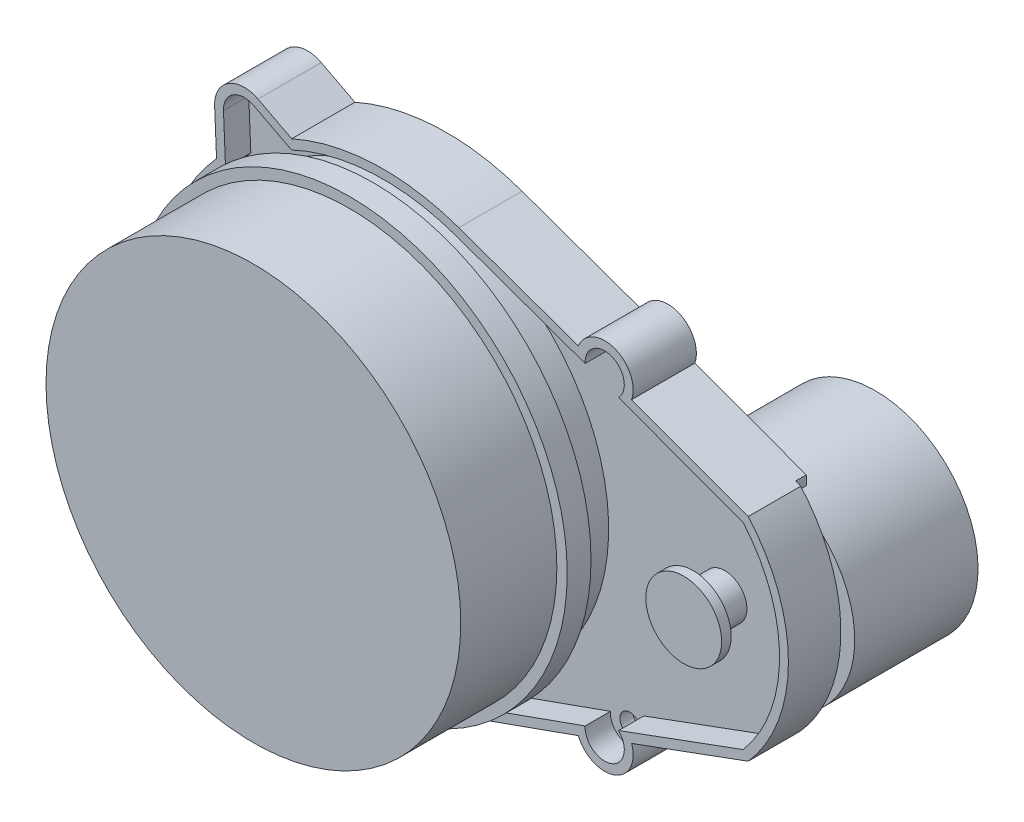
from build123d import *

# Parameters (mm, degrees)
SKETCH_2_R               = 32.8
EXTRUDE_1_DEPTH          = 15.2
SKETCH_5_R               = 34.43969611
EXTRUDE_2_DEPTH          = 3.765573
SKETCH_7_R               = 31.937051091
EXTRUDE_3_DEPTH          = 0.8
SKETCH_8_R               = 31.627841621
EXTRUDE_4_DEPTH          = 4.8
EXTRUDE_6_DEPTH          = 2
EXTRUDE_START            = 4
EXTRUDE_7_DEPTH          = 4
EXTRUDE_8_DEPTH          = 6
CUT_EXTRUDE_1_DEPTH      = 1.7
SKETCH_14_R              = 3.5
EXTRUDE_9_DEPTH          = 5
SKETCH_15_R              = 6
EXTRUDE_10_DEPTH         = 1.5
EXTRUDE_START_2          = 2.3
SKETCH_16_R              = 3.5
EXTRUDE_11_DEPTH         = 2.3
SKETCH_17_R              = 16.25
EXTRUDE_12_DEPTH         = 19.5
SKETCH_18_R              = 3.75
EXTRUDE_13_DEPTH         = 3.43
EXTRUDE_14_DEPTH         = 12.23
CUT_EXTRUDE_2_DEPTH      = 81.031402587
CUT_EXTRUDE_2_DEPTH_BACK = 81.031402587
SKETCH_20_R              = 1.6
SKETCH_21_R              = 5.25
CUT_EXTRUDE_3_DEPTH      = 20


with BuildPart() as part:
    # 스케치2 → 보스-돌출1 (new body)
    with BuildSketch(Plane.XY):
        with Locations(Location((0, 0, 0), (0, 0, 180))):
            Circle(SKETCH_2_R)
    extrude(amount=EXTRUDE_1_DEPTH)

    # 스케치5 → 보스-돌출2 (add)
    with BuildSketch(Plane.XY):
        Circle(SKETCH_5_R)
    extrude(amount=-EXTRUDE_2_DEPTH)

    # 스케치7 → 보스-돌출3 (add)
    with BuildSketch(Plane(origin=(0, 0, -3.765572979), x_dir=(-1, 0, 0), z_dir=(0, 0, -1))):
        Circle(SKETCH_7_R)
    extrude(amount=EXTRUDE_3_DEPTH)

    # 스케치8 → 보스-돌출4 (add)
    with BuildSketch(Plane(origin=(0, 0, -4.565572979), x_dir=(-1, 0, 0), z_dir=(0, 0, -1))):
        Circle(SKETCH_8_R)
    extrude(amount=EXTRUDE_4_DEPTH)

    # 스케치10 → 보스-돌출6 (add)
    with BuildSketch(Plane(origin=(0, 0, -9.365572979), x_dir=(-1, 0, 0), z_dir=(0, 0, -1))):
        with BuildLine():
            Line((-30.830427643, -26.692532528), (-11.928490857, -33.435925378))
            ThreePointArc((-11.928490857, -33.435925378), (1.386891377, -35.472898561), (14.502591336, -32.402543797))
            Line((14.502591336, -32.402543797), (19.833940849, -35.171113491))
            ThreePointArc((19.833940849, -35.171113491), (24.525943879, -34.963534725), (26.69566429, -30.798166229))
            Line((26.69566429, -30.798166229), (26.392377939, -23.742206863))
            ThreePointArc((26.392377939, -23.742206863), (35.5, 0), (26.392377939, 23.742206863))
            Line((26.392377939, 23.742206863), (26.69566429, 30.798166229))
            ThreePointArc((26.69566429, 30.798166229), (24.525943879, 34.963534725), (19.833940849, 35.171113491))
            Line((19.833940849, 35.171113491), (14.502591336, 32.402543797))
            ThreePointArc((14.502591336, 32.402543797), (1.386891377, 35.472898561), (-11.928490857, 33.435925378))
            Line((-11.928490857, 33.435925378), (-30.830427643, 26.692532528))
            ThreePointArc((-30.830427643, 26.692532528), (-36.575929002, 29.215026427), (-39.257220366, 23.541893434))
            Line((-39.257220366, 23.541893434), (-57.703429714, 16.761281639))
            ThreePointArc((-57.703429714, 16.761281639), (-64.057876626, 0), (-57.703429714, -16.761281639))
            Line((-57.703429714, -16.761281639), (-39.257220366, -23.541893434))
            ThreePointArc((-39.257220366, -23.541893434), (-36.575929002, -29.215026427), (-30.830427643, -26.692532528))
        make_face()
    extrude(amount=EXTRUDE_6_DEPTH)

    # 스케치12 → 보스-돌출7 (add)
    with BuildSketch(Plane.XY.offset(-9.365572979).offset(EXTRUDE_START)):
        with BuildLine():
            Line((-26.392377939, -23.742206863), (-26.69566429, -30.798166229))
            ThreePointArc((-26.69566429, -30.798166229), (-24.525943879, -34.963534725), (-19.833940849, -35.171113491))
            Line((-19.833940849, -35.171113491), (-14.502591336, -32.402543797))
            ThreePointArc((-14.502591336, -32.402543797), (-1.386891377, -35.472898561), (11.928490857, -33.435925378))
            Line((11.928490857, -33.435925378), (30.830427643, -26.692532528))
            ThreePointArc((30.830427643, -26.692532528), (36.575929002, -29.215026427), (39.257220366, -23.541893434))
            Line((39.257220366, -23.541893434), (57.703429714, -16.761281639))
            ThreePointArc((57.703429714, -16.761281639), (64.057876626, 0), (57.703429714, 16.761281639))
            Line((57.703429714, 16.761281639), (39.257220366, 23.541893434))
            ThreePointArc((39.257220366, 23.541893434), (36.575929002, 29.215026427), (30.830427643, 26.692532528))
            Line((30.830427643, 26.692532528), (11.928490857, 33.435925378))
            ThreePointArc((11.928490857, 33.435925378), (-1.386891377, 35.472898561), (-14.502591336, 32.402543797))
            Line((-14.502591336, 32.402543797), (-19.833940849, 35.171113491))
            ThreePointArc((-19.833940849, 35.171113491), (-24.525943879, 34.963534725), (-26.69566429, 30.798166229))
            Line((-26.69566429, 30.798166229), (-26.392377939, 23.742206863))
            ThreePointArc((-26.392377939, 23.742206863), (-35.5, 0), (-26.392377939, -23.742206863))
        make_face()
        with BuildLine():
            Line((-24.968823812, -23.224294122), (-25.296955778, -30.858286926))
            ThreePointArc((-25.296955778, -30.858286926), (-23.773535064, -33.78290736), (-20.479149958, -33.928654153))
            Line((-20.479149958, -33.928654153), (-14.540295767, -30.844607292))
            ThreePointArc((-14.540295767, -30.844607292), (-1.667327059, -34.059213445), (11.458071499, -32.117325504))
            Line((11.458071499, -32.117325504), (31.905073194, -24.822720374))
            ThreePointArc((31.905073194, -24.822720374), (36.103194509, -27.897060903), (37.193109232, -22.809047719))
            Line((37.193109232, -22.809047719), (56.884193028, -15.570834571))
            ThreePointArc((56.884193028, -15.570834571), (62.657876626, 0), (56.884193028, 15.570834571))
            Line((56.884193028, 15.570834571), (37.193109232, 22.809047719))
            ThreePointArc((37.193109232, 22.809047719), (36.103194509, 27.897060903), (31.905073194, 24.822720374))
            Line((31.905073194, 24.822720374), (11.458071499, 32.117325504))
            ThreePointArc((11.458071499, 32.117325504), (-1.667327059, 34.059213445), (-14.540295767, 30.844607292))
            Line((-14.540295767, 30.844607292), (-20.479149958, 33.928654153))
            ThreePointArc((-20.479149958, 33.928654153), (-23.773535064, 33.78290736), (-25.296955778, 30.858286926))
            Line((-25.296955778, 30.858286926), (-24.968823812, 23.224294122))
            ThreePointArc((-24.968823812, 23.224294122), (-34.1, 0), (-24.968823812, -23.224294122))
        make_face(mode=Mode.SUBTRACT)
    extrude(amount=-EXTRUDE_7_DEPTH)

    # 스케치12<2> → 보스-돌출8 (add)
    with BuildSketch(Plane.XY.offset(-9.365572979)):
        with BuildLine():
            Line((-26.392377939, -23.742206863), (-26.69566429, -30.798166229))
            ThreePointArc((-26.69566429, -30.798166229), (-24.525943879, -34.963534725), (-19.833940849, -35.171113491))
            Line((-19.833940849, -35.171113491), (-14.502591336, -32.402543797))
            ThreePointArc((-14.502591336, -32.402543797), (-1.386891377, -35.472898561), (11.928490857, -33.435925378))
            Line((11.928490857, -33.435925378), (30.830427643, -26.692532528))
            ThreePointArc((30.830427643, -26.692532528), (36.575929002, -29.215026427), (39.257220366, -23.541893434))
            Line((39.257220366, -23.541893434), (57.703429714, -16.761281639))
            ThreePointArc((57.703429714, -16.761281639), (64.057876626, 0), (57.703429714, 16.761281639))
            Line((57.703429714, 16.761281639), (39.257220366, 23.541893434))
            ThreePointArc((39.257220366, 23.541893434), (36.575929002, 29.215026427), (30.830427643, 26.692532528))
            Line((30.830427643, 26.692532528), (11.928490857, 33.435925378))
            ThreePointArc((11.928490857, 33.435925378), (-1.386891377, 35.472898561), (-14.502591336, 32.402543797))
            Line((-14.502591336, 32.402543797), (-19.833940849, 35.171113491))
            ThreePointArc((-19.833940849, 35.171113491), (-24.525943879, 34.963534725), (-26.69566429, 30.798166229))
            Line((-26.69566429, 30.798166229), (-26.392377939, 23.742206863))
            ThreePointArc((-26.392377939, 23.742206863), (-35.5, 0), (-26.392377939, -23.742206863))
        make_face()
        with BuildLine():
            Line((-24.968823812, -23.224294122), (-25.296955778, -30.858286926))
            ThreePointArc((-25.296955778, -30.858286926), (-23.773535064, -33.78290736), (-20.479149958, -33.928654153))
            Line((-20.479149958, -33.928654153), (-14.540295767, -30.844607292))
            ThreePointArc((-14.540295767, -30.844607292), (-1.667327059, -34.059213445), (11.458071499, -32.117325504))
            Line((11.458071499, -32.117325504), (31.905073194, -24.822720374))
            ThreePointArc((31.905073194, -24.822720374), (36.103194509, -27.897060903), (37.193109232, -22.809047719))
            Line((37.193109232, -22.809047719), (56.884193028, -15.570834571))
            ThreePointArc((56.884193028, -15.570834571), (62.657876626, 0), (56.884193028, 15.570834571))
            Line((56.884193028, 15.570834571), (37.193109232, 22.809047719))
            ThreePointArc((37.193109232, 22.809047719), (36.103194509, 27.897060903), (31.905073194, 24.822720374))
            Line((31.905073194, 24.822720374), (11.458071499, 32.117325504))
            ThreePointArc((11.458071499, 32.117325504), (-1.667327059, 34.059213445), (-14.540295767, 30.844607292))
            Line((-14.540295767, 30.844607292), (-20.479149958, 33.928654153))
            ThreePointArc((-20.479149958, 33.928654153), (-23.773535064, 33.78290736), (-25.296955778, 30.858286926))
            Line((-25.296955778, 30.858286926), (-24.968823812, 23.224294122))
            ThreePointArc((-24.968823812, 23.224294122), (-34.1, 0), (-24.968823812, -23.224294122))
        make_face(mode=Mode.SUBTRACT)
    extrude(amount=-EXTRUDE_8_DEPTH)

    # 스케치13 → 컷-돌출1 (cut)
    with BuildSketch(Plane(origin=(0, 0, -15.365572979), x_dir=(-1, 0, 0), z_dir=(0, 0, -1))):
        Polygon((-56.884193028, -15.570834571), (-56.884193028, 17.062423507), (-56.884193028, 21.549560303), (-68.095644454, 21.549560303), (-68.095644454, -21.067118875), (-56.884193028, -21.067118875), align=None)
    extrude(amount=-CUT_EXTRUDE_1_DEPTH, mode=Mode.SUBTRACT)

    # 스케치14 → 보스-돌출9 (add)
    with BuildSketch(Plane.XY.offset(-9.365572979)):
        with Locations(Location((50, 0, 0), (0, 0, 180))):
            Circle(SKETCH_14_R)
    extrude(amount=EXTRUDE_9_DEPTH)

    # 스케치15 → 보스-돌출10 (add)
    with BuildSketch(Plane.XY.offset(-4.365572979)):
        with Locations((50, 0)):
            Circle(SKETCH_15_R)
    extrude(amount=EXTRUDE_10_DEPTH)

    # 스케치16 → 보스-돌출11 (add)
    with BuildSketch(Plane(origin=(0, 0, -11.365572979), x_dir=(-1, 0, 0), z_dir=(0, 0, -1)).offset(EXTRUDE_START_2)):
        with Locations((-50, 0)):
            Circle(SKETCH_16_R)
    extrude(amount=-EXTRUDE_11_DEPTH)

    # 스케치17 → 보스-돌출12 (add)
    with BuildSketch(Plane(origin=(0, 0, -13.665572979), x_dir=(-1, 0, 0), z_dir=(0, 0, -1))):
        with Locations(Location((-50, 0, 0), (0, 0, 133.077401672))):
            Circle(SKETCH_17_R)
    extrude(amount=EXTRUDE_12_DEPTH)

    # 스케치18 → 보스-돌출13 (add)
    with BuildSketch(Plane(origin=(0, 0, -33.165572979), x_dir=(-1, 0, 0), z_dir=(0, 0, -1))):
        with Locations(Location((-50, 0, 0), (0, 0, 180))):
            Circle(SKETCH_18_R)
    extrude(amount=EXTRUDE_13_DEPTH)

    # 스케치19 → 보스-돌출14 (add)
    with BuildSketch(Plane(origin=(0, 0, -11.365572979), x_dir=(-1, 0, 0), z_dir=(0, 0, -1))):
        with BuildLine():
            Line((-28.5, 0), (-28.5, -27.523928235))
            Line((-28.5, -27.523928235), (-11.928490857, -33.435925378))
            ThreePointArc((-11.928490857, -33.435925378), (-7.281580797, -34.745195079), (-2.5, -35.411862419))
            Line((-2.5, -35.411862419), (-2.5, 0))
            ThreePointArc((-2.5, 0), (-15.5, 13), (-28.5, 0))
        make_face()
    extrude(amount=EXTRUDE_14_DEPTH)

    # 스케치20 → 컷-돌출2 (cut, two sides: drawn at the far end of the back side and taken through both)
    with BuildSketch(Plane.XY.offset(-9.365572979).offset(-CUT_EXTRUDE_2_DEPTH_BACK)):
        with Locations(Location((35, -25, 0), (0, 0, 180))):
            Circle(SKETCH_20_R)
        with Locations(Location((-22, -31, 0), (0, 0, 180))):
            Circle(SKETCH_20_R)
        with Locations(Location((35, 25, 0), (0, 0, 180))):
            Circle(SKETCH_20_R)
        with Locations(Location((-22, 31, 0), (0, 0, 180))):
            Circle(SKETCH_20_R)
    extrude(amount=CUT_EXTRUDE_2_DEPTH + CUT_EXTRUDE_2_DEPTH_BACK, mode=Mode.SUBTRACT)

    # 스케치21 → 컷-돌출3 (cut)
    with BuildSketch(Plane(origin=(0, -33, 0), x_dir=(1, 0, 0), z_dir=(0, 1, 0))):
        with Locations(Location((15.9, -5.8, 0), (0, 0, 90))):
            Circle(SKETCH_21_R)
        with Locations(Location((-19.5, -5.8, 0), (0, 0, 90))):
            Circle(SKETCH_21_R)
    extrude(amount=CUT_EXTRUDE_3_DEPTH, mode=Mode.SUBTRACT)


solid = part.part
